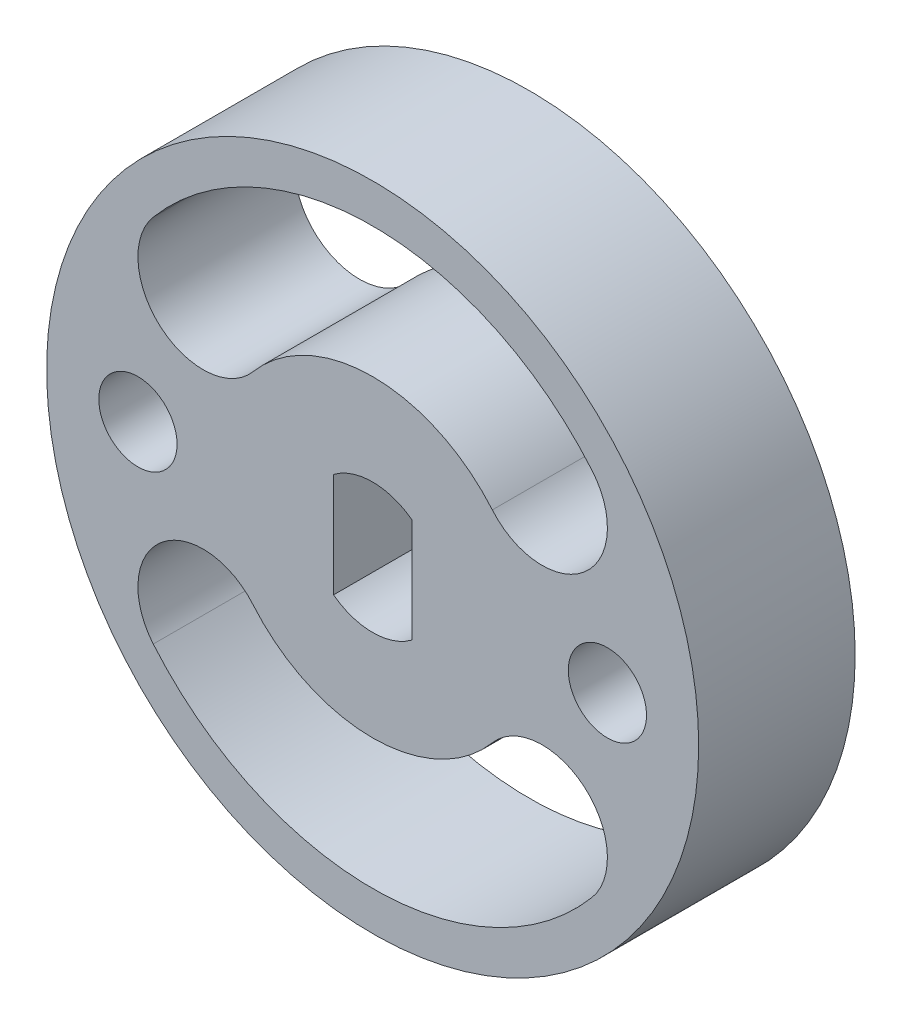
from build123d import *
from build123d.topology import SkipClean

# Parameters (mm, degrees)
BOSS_EXTRUDE1_DEPTH = 6
CUT_EXTRUDE1_DEPTH  = 6


with BuildPart() as part:
    # Sketch1 → Boss-Extrude1 (new body)
    with BuildSketch(Plane.XY):
        with BuildLine():
            Line((1.5, 2), (1.5, 0))
            Line((1.5, 0), (7.5, 0))
            ThreePointArc((7.5, 0), (9, 1.5), (10.5, 0))
            Line((10.5, 0), (12.5, 0))
            ThreePointArc((12.5, 0), (8.838834765, 8.838834765), (0, 12.5))
            Line((0, 12.5), (0, 2.5))
            ThreePointArc((0, 2.5), (0.790569415, 2.371708245), (1.5, 2))
        make_face()
    extrude(amount=BOSS_EXTRUDE1_DEPTH)

    # Mirror4: part across plane


with BuildPart() as part_1:
    add(part.part)
    add(part.part.mirror(Plane(origin=(0, 12.5, 6), x_dir=(0, 0, 1), z_dir=(1, 0, 0))))

    # Sketch2 → Cut-Extrude1 (cut)
    with BuildSketch(Plane.XY.offset(6)):
        with BuildLine():
            ThreePointArc((8.411764706, 7.088174274), (0, 11), (-8.411764706, 7.088174274))
            ThreePointArc((-8.411764706, 7.088174274), (-8.110948699, 3.565460869), (-4.588235294, 3.866276877))
            ThreePointArc((-4.588235294, 3.866276877), (0, 6), (4.588235294, 3.866276877))
            ThreePointArc((4.588235294, 3.866276877), (8.110948699, 3.565460869), (8.411764706, 7.088174274))
        make_face()
    extrude(amount=-CUT_EXTRUDE1_DEPTH, mode=Mode.SUBTRACT)

    # Mirror5: part across plane


with BuildPart() as part_2:
    with SkipClean():  # the faces are left unmerged after this step: merging them gives an invalid solid
        add(part_1.part)
        add(part_1.part.mirror(Plane(origin=(-1.5, 0, 6), x_dir=(0, 0, 1), z_dir=(0, 1, 0))))


solid = part_2.part
